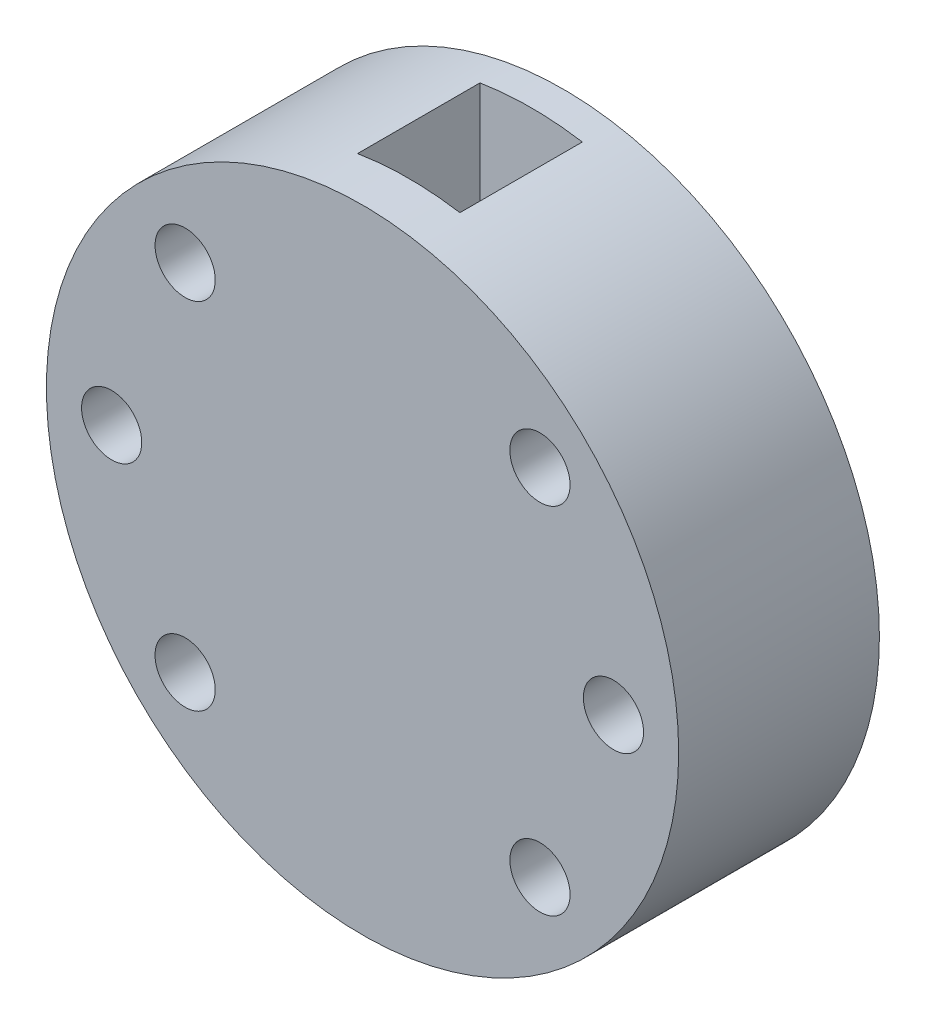
from build123d import *

# Parameters (mm, degrees)
SKETCH2_R               = 31.5
SKETCH2_R_2             = 4.5
BOSS_EXTRUDE2_DEPTH     = 20
CUT_EXTRUDE1_DEPTH      = 26
CUT_EXTRUDE1_DEPTH_BACK = 80
SKETCH3_W               = 10.2
SKETCH3_H               = 12.2
SKETCH2_4_R             = 4.5
BOSS_EXTRUDE3_DEPTH     = 20
SKETCH2_5_R             = 4.5
CUT_EXTRUDE2_DEPTH      = 6
SKETCH2_6_R             = 3
CUT_EXTRUDE3_DEPTH      = 20


with BuildPart() as part:
    # Sketch2 → Boss-Extrude2 (new body)
    with BuildSketch(Plane.XY):
        Circle(SKETCH2_R)
        with Locations((17.67766953, 17.67766953)):
            Circle(SKETCH2_R_2, mode=Mode.SUBTRACT)
        with Locations((-17.67766953, 17.67766953)):
            Circle(SKETCH2_R_2, mode=Mode.SUBTRACT)
        with Locations((-25, 0)):
            Circle(SKETCH2_R_2, mode=Mode.SUBTRACT)
        with Locations((-17.67766953, -17.67766953)):
            Circle(SKETCH2_R_2, mode=Mode.SUBTRACT)
        with Locations((17.67766953, -17.67766953)):
            Circle(SKETCH2_R_2, mode=Mode.SUBTRACT)
        with Locations((25, 0)):
            Circle(SKETCH2_R_2, mode=Mode.SUBTRACT)
    extrude(amount=BOSS_EXTRUDE2_DEPTH)

    # Sketch3 → Cut-Extrude1 (cut, two sides: drawn at the far end of the back side and taken through both)
    with BuildSketch(Plane(origin=(0, 32.253829663, 0), x_dir=(1, 0, 0), z_dir=(0, 1, 0)).offset(-CUT_EXTRUDE1_DEPTH_BACK)):
        with Locations((0, -9.3)):
            Rectangle(SKETCH3_W, SKETCH3_H)
    extrude(amount=CUT_EXTRUDE1_DEPTH + CUT_EXTRUDE1_DEPTH_BACK, mode=Mode.SUBTRACT)

    # Sketch2<4> → Boss-Extrude3 (add)
    with BuildSketch(Plane.XY):
        with Locations((-17.67766953, 17.67766953)):
            Circle(SKETCH2_4_R)
        with Locations((-25, 0)):
            Circle(SKETCH2_4_R)
        with Locations((-17.67766953, -17.67766953)):
            Circle(SKETCH2_4_R)
        with Locations((17.67766953, 17.67766953)):
            Circle(SKETCH2_4_R)
        with Locations((25, 0)):
            Circle(SKETCH2_4_R)
        with Locations((17.67766953, -17.67766953)):
            Circle(SKETCH2_4_R)
    extrude(amount=BOSS_EXTRUDE3_DEPTH)

    # Sketch2<5> → Cut-Extrude2 (cut)
    with BuildSketch(Plane.XY):
        with Locations((-17.67766953, 17.67766953)):
            Circle(SKETCH2_5_R)
        with Locations((-25, 0)):
            Circle(SKETCH2_5_R)
        with Locations((-17.67766953, -17.67766953)):
            Circle(SKETCH2_5_R)
        with Locations((17.67766953, 17.67766953)):
            Circle(SKETCH2_5_R)
        with Locations((25, 0)):
            Circle(SKETCH2_5_R)
        with Locations((17.67766953, -17.67766953)):
            Circle(SKETCH2_5_R)
    extrude(amount=CUT_EXTRUDE2_DEPTH, mode=Mode.SUBTRACT)

    # Sketch2<6> → Cut-Extrude3 (cut)
    with BuildSketch(Plane.XY):
        with Locations((-17.67766953, 17.67766953)):
            Circle(SKETCH2_6_R)
        with Locations((-25, 0)):
            Circle(SKETCH2_6_R)
        with Locations((-17.67766953, -17.67766953)):
            Circle(SKETCH2_6_R)
        with Locations((17.67766953, 17.67766953)):
            Circle(SKETCH2_6_R)
        with Locations((25, 0)):
            Circle(SKETCH2_6_R)
        with Locations((17.67766953, -17.67766953)):
            Circle(SKETCH2_6_R)
    extrude(amount=CUT_EXTRUDE3_DEPTH, mode=Mode.SUBTRACT)


solid = part.part
